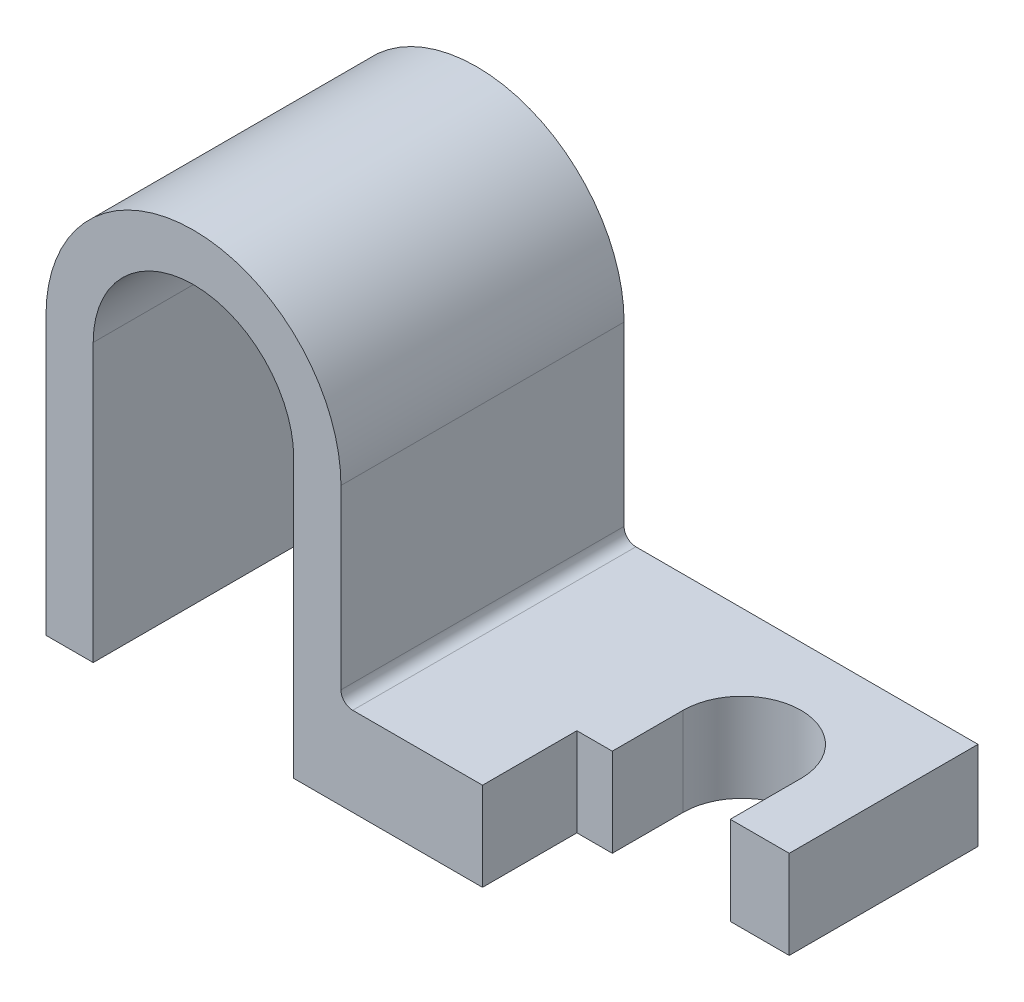
from build123d import *

# Parameters (mm, degrees)
EXTRUDE_1_DEPTH     = 48
CUT_EXTRUDE_1_DEPTH = 48
FILLET_1_R          = 2


with BuildPart() as part:
    # 草圖1 → 填料-伸長1 (new body)
    with BuildSketch(Plane.XY):
        with BuildLine():
            Line((0, 0), (8, 0))
            Line((8, 0), (8, 47))
            ThreePointArc((8, 47), (25, 64), (42, 47))
            Line((42, 47), (42, 0))
            Line((42, 0), (110, 0))
            Line((110, 0), (110, 15))
            Line((110, 15), (50, 15))
            Line((50, 15), (50, 47))
            ThreePointArc((50, 47), (25, 72), (0, 47))
            Line((0, 47), (0, 0))
        make_face()
    extrude(amount=-EXTRUDE_1_DEPTH)

    # 草圖2 → 除料-伸長1 (cut)
    with BuildSketch(Plane(origin=(0, 15, 0), x_dir=(1, 0, 0), z_dir=(0, 1, 0))):
        with BuildLine():
            Line((74, 0), (74, 16))
            Line((74, 16), (80, 16))
            Line((80, 16), (80, 28))
            ThreePointArc((80, 28), (90, 38), (100, 28))
            Line((100, 28), (100, 16))
            Line((100, 16), (110, 16))
            Line((110, 16), (110, 0))
            Line((110, 0), (74, 0))
        make_face()
    extrude(amount=-CUT_EXTRUDE_1_DEPTH, mode=Mode.SUBTRACT)

    # 圓角1
    fillet_1_edges = [part.edges().sort_by_distance(p)[0] for p in [
        (50, 15, -24),
    ]]
    fillet(fillet_1_edges, radius=FILLET_1_R)


solid = part.part
